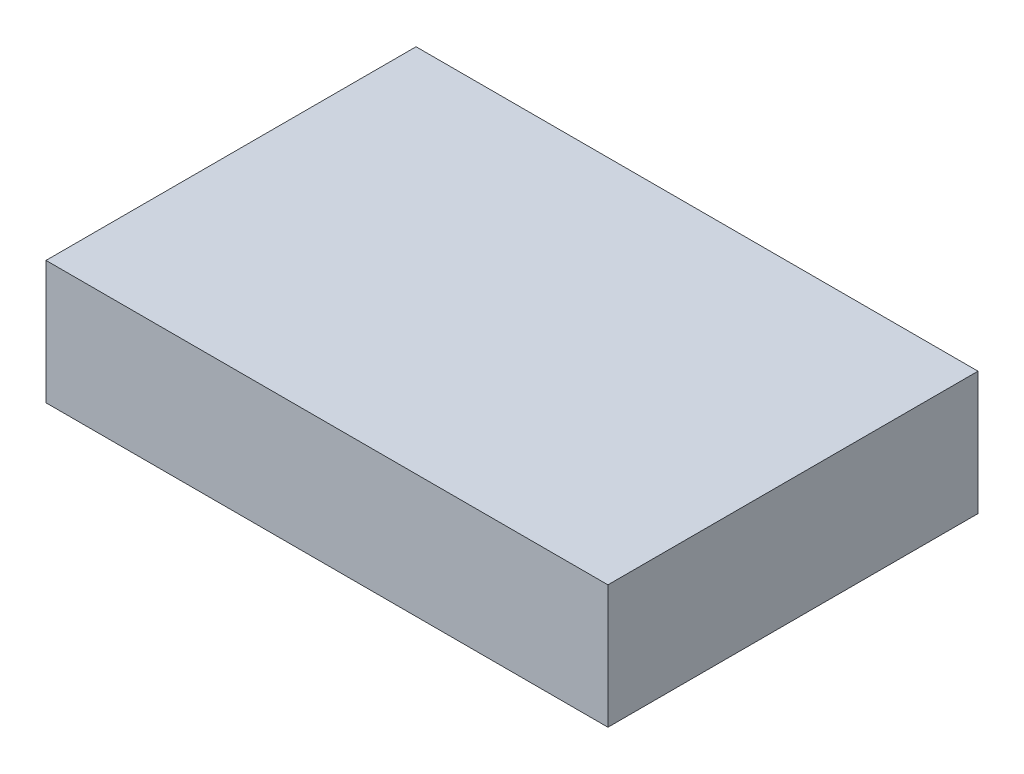
from build123d import *

# Parameters (mm, degrees)
ESBO_O1_W                = 82
ESBO_O1_H                = 54
RESSALTO_EXTRUS_O1_DEPTH = 18


with BuildPart() as part:
    # Esboço1 → Ressalto-extrusão1 (new body)
    with BuildSketch(Plane(origin=(0, 0, 0), x_dir=(1, 0, 0), z_dir=(0, 1, 0))):
        Rectangle(ESBO_O1_W, ESBO_O1_H)
    extrude(amount=RESSALTO_EXTRUS_O1_DEPTH)


solid = part.part
